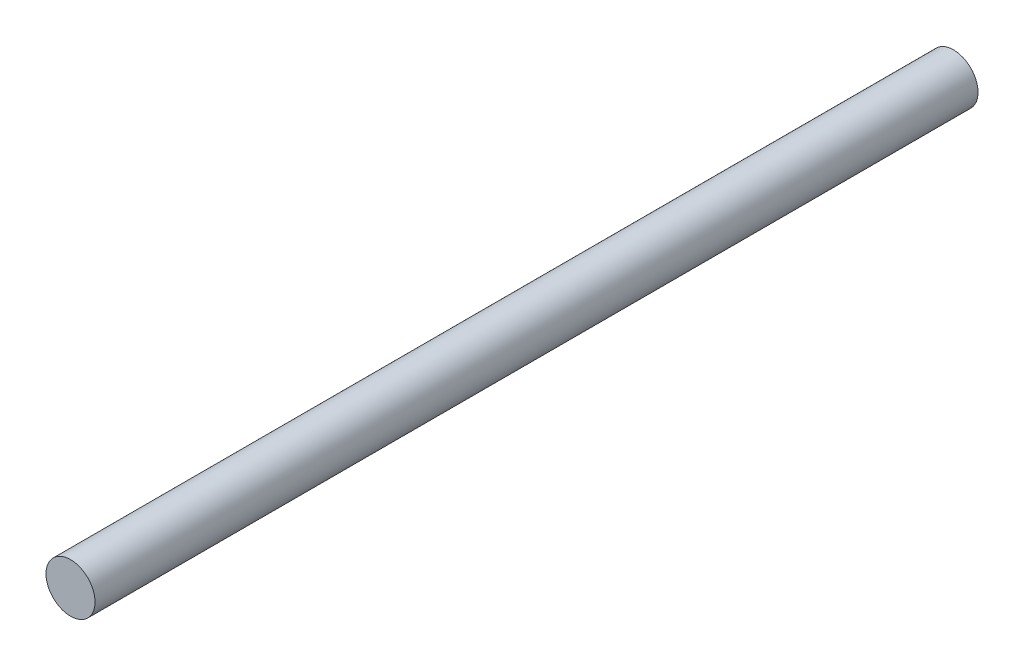
from build123d import *

# Parameters (mm, degrees)
SKETCH1_R           = 2.5
BOSS_EXTRUDE1_DEPTH = 90


with BuildPart() as part:
    # Sketch1 → Boss-Extrude1 (new body)
    with BuildSketch(Plane.XY):
        with Locations(Location((0, 0, 0), (0, 0, 180))):
            Circle(SKETCH1_R)
    extrude(amount=BOSS_EXTRUDE1_DEPTH)


solid = part.part
